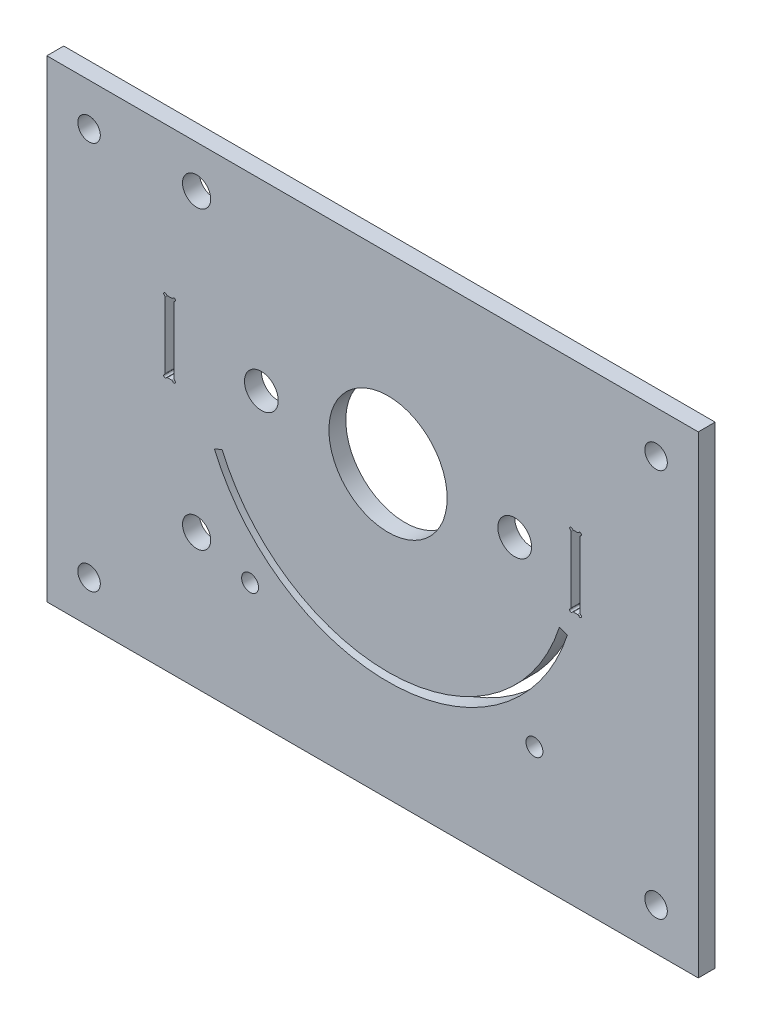
from build123d import *

# Parameters (mm, degrees)
SKETCH2_R                  = 21
SKETCH2_W                  = 3.2
SKETCH2_H                  = 25.2
BOSS_EXTRUDE1_DEPTH        = 3
F_10_0_10_DIAMETER_HOLE1_D = 10
F_8_0_8_DIAMETER_HOLE1_D   = 8
F_12_0_12_DIAMETER_HOLE1_D = 12
CUT_EXTRUDE1_DEPTH         = 160.1679616
CUT_EXTRUDE1_DEPTH_BACK    = 160.1679616
F_6_0_6_DIAMETER_HOLE2_D   = 6
SKETCH27_R                 = 0.5
CUT_EXTRUDE2_DEPTH         = 160.1679616
FILLET1_R                  = 0.5


with BuildPart() as part:
    # Sketch2 → Boss-Extrude1 (new, symmetric)
    with BuildSketch(Plane.XY):
        Polygon((-68, 65), (95.2, 65), (110.2, 65), (110.2, -103), (0, -103), (-121.2, -103), (-121.2, 65), (-106.2, 65), align=None)
        Circle(SKETCH2_R, mode=Mode.SUBTRACT)
        with Locations((-77.6, 0)):
            Rectangle(SKETCH2_W, SKETCH2_H, mode=Mode.SUBTRACT)
        with Locations((66.6, 0)):
            Rectangle(SKETCH2_W, SKETCH2_H, mode=Mode.SUBTRACT)
    extrude(amount=BOSS_EXTRUDE1_DEPTH, both=True)

    # Ø10.0 (10) Diameter Hole1 (through all)
    with Locations(Plane.XY.offset(3)):
        with Locations((-68, 50), (-68, -55)):
            Hole(F_10_0_10_DIAMETER_HOLE1_D / 2)

    # Ø8.0 (8) Diameter Hole1 (through all)
    with Locations(Plane.XY.offset(3)):
        with Locations((-106.2, 50), (-106.2, -88), (95.2, -88), (95.2, 50)):
            Hole(F_8_0_8_DIAMETER_HOLE1_D / 2)

    # Ø12.0 (12) Diameter Hole1 (through all)
    with Locations(Plane(origin=(0, 0, -3), x_dir=(-1, 0, 0), z_dir=(0, 0, -1))):
        with Locations((-45, 0), (45, 0)):
            Hole(F_12_0_12_DIAMETER_HOLE1_D / 2)

    # Sketch18 → Cut-Extrude1 (cut, two sides: drawn at the far end of the back side and taken through both)
    with BuildSketch(Plane.XY.offset(3).offset(-CUT_EXTRUDE1_DEPTH_BACK)):
        with BuildLine():
            Line((-58.912310621, -25.006792223), (-61.673825181, -26.178985609))
            ThreePointArc((-61.673825181, -26.178985609), (2.922498953, -66.936230846), (63.720786592, -20.704138623))
            Line((63.720786592, -20.704138623), (60.867617043, -19.77708764))
            ThreePointArc((60.867617043, -19.77708764), (2.791640791, -63.939086181), (-58.912310621, -25.006792223))
        make_face()
    extrude(amount=CUT_EXTRUDE1_DEPTH + CUT_EXTRUDE1_DEPTH_BACK, mode=Mode.SUBTRACT)

    # Ø6.0 (6) Diameter Hole2 (through all)
    with Locations(Plane(origin=(0, 0, -3), x_dir=(-1, 0, 0), z_dir=(0, 0, -1))):
        with Locations((49, -61), (-52, -61)):
            Hole(F_6_0_6_DIAMETER_HOLE2_D / 2)

    # Sketch27 → Cut-Extrude2 (cut, through all)
    with BuildSketch(Plane(origin=(0, 0, -3), x_dir=(-1, 0, 0), z_dir=(0, 0, -1))):
        with Locations((-65, 12.6)):
            Circle(SKETCH27_R)
        with Locations((-68.2, 12.6)):
            Circle(SKETCH27_R)
        with Locations((-65, -12.6)):
            Circle(SKETCH27_R)
        with Locations((-68.2, -12.6)):
            Circle(SKETCH27_R)
        with Locations((79.2, 12.6)):
            Circle(SKETCH27_R)
        with Locations((76, 12.6)):
            Circle(SKETCH27_R)
        with Locations((79.2, -12.6)):
            Circle(SKETCH27_R)
        with Locations((76, -12.6)):
            Circle(SKETCH27_R)
    extrude(amount=-CUT_EXTRUDE2_DEPTH, mode=Mode.SUBTRACT)

    # Fillet1
    fillet1_edges = [part.edges().sort_by_distance(p)[0] for p in [
        (68.2, 12.1, 0),
        (68.2, -12.1, 0),
        (65.5, -12.6, 0),
        (65, 12.1, 0),
        (-76, 12.1, 0),
        (-76, -12.1, 0),
        (-78.7, -12.6, 0),
        (-79.2, 12.1, 0),
        (-78.7, 12.6, 0),
        (67.7, -12.6, 0),
        (65, -12.1, 0),
        (67.7, 12.6, 0),
        (-76.5, -12.6, 0),
        (-79.2, -12.1, 0),
        (-76.5, 12.6, 0),
        (65.5, 12.6, 0),
    ]]
    fillet(fillet1_edges, radius=FILLET1_R)


solid = part.part
